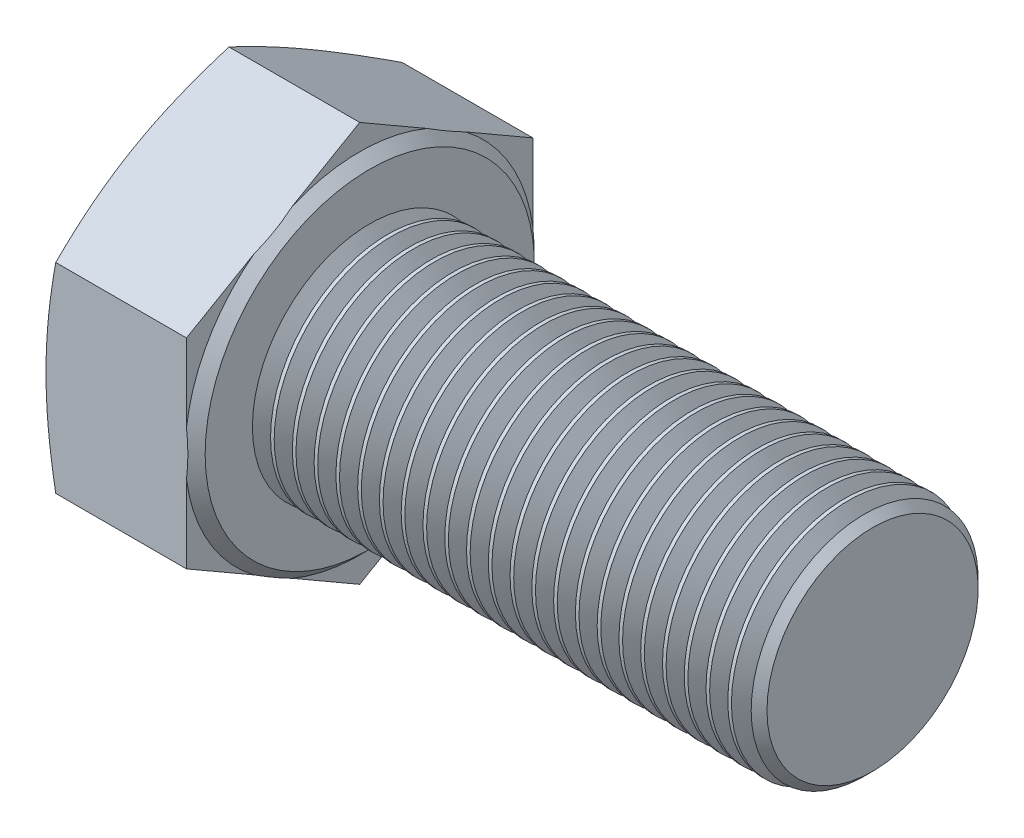
from build123d import *

# Parameters (mm, degrees)
BASEHEAD_DEPTH   = 8.98
SKETCH5_R        = 7
BASEBODY_DEPTH   = 30
CHAMFER1_SIZE    = 0.7
LPATTERN10_COUNT = 23
LPATTERN10_PITCH = 1.299


with BuildPart() as part:
    # Sketch2 → BaseHead (new body)
    with BuildSketch(Plane(origin=(0, 0, 0), x_dir=(0, 0, -1), z_dir=(1, 0, 0))):
        Polygon((10.335, -5.966915032), (10.335, 5.966915032), (0, 11.933830064), (-10.335, 5.966915032), (-10.335, -5.966915032), (0, -11.933830064), align=None)
    extrude(amount=BASEHEAD_DEPTH)

    # Sketch3 → BearingFace (revolve, cut)
    with BuildSketch(Plane.XY, mode=Mode.PRIVATE) as bearingface_sk:
        Polygon((8.98, 11.933830064), (8.98, 9.82), (8.38, 10.42), (8.38, 11.933830064), align=None)
    revolve(bearingface_sk.sketch.rotate(Axis((-0.957090588, 0, 0), (1, 0, 0)), 90), axis=Axis((-0.957090588, 0, 0), (1, 0, 0)), mode=Mode.SUBTRACT)

    # Sketch4 → HeadChamfer (revolve, cut)
    with BuildSketch(Plane.XY):
        Polygon((0, 11.933830064), (0.581926553, 11.933830064), (0, 10.335), align=None)
    revolve(axis=Axis((-0.493528746, 0, 0), (1, 0, 0)), mode=Mode.SUBTRACT)

    # Sketch5 → BaseBody (add)
    with BuildSketch(Plane(origin=(8.98, 0, 0), x_dir=(0, 0, -1), z_dir=(1, 0, 0))):
        Circle(SKETCH5_R)
    extrude(amount=BASEBODY_DEPTH)

    # Chamfer1
    chamfer1_edges = [part.edges().sort_by_distance(p)[0] for p in [
        (38.98, 0, 7),
    ]]
    chamfer(chamfer1_edges, length=CHAMFER1_SIZE)

    # Sketch6 → Cut-Revolve10 (revolve, cut)
    with BuildSketch(Plane.XY, mode=Mode.PRIVATE) as cut_revolve10_sk:
        Polygon((8.98, 8.0825), (10.0625, 8.0825), (10.0625, 7), (9.52125, 6.0625275), (8.98, 7), align=None)
    cut_revolve10 = revolve(cut_revolve10_sk.sketch.rotate(Axis((-0.957090588, 0, 0), (1, 0, 0)), 90), axis=Axis((-0.957090588, 0, 0), (1, 0, 0)), mode=Mode.SUBTRACT)

    # LPattern10: Cut-Revolve10 ×23
    with Locations(*[(i * LPATTERN10_PITCH, 0, 0) for i in range(1, LPATTERN10_COUNT)]):
        add(cut_revolve10, mode=Mode.SUBTRACT)


solid = part.part
